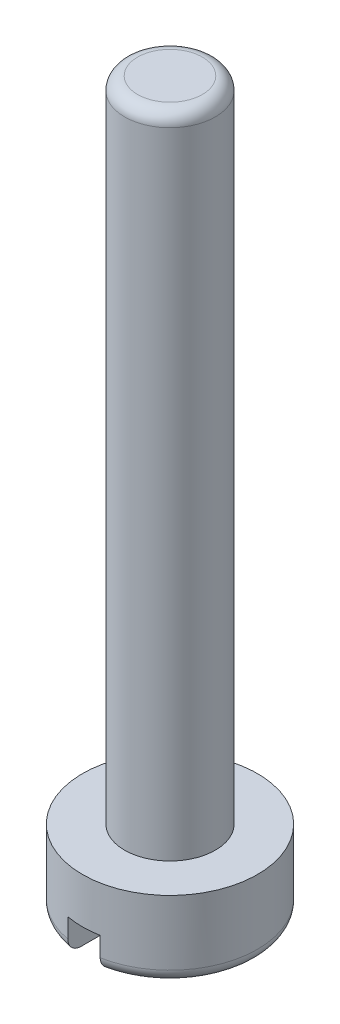
from build123d import *

# Parameters (mm, degrees)
SKETCH2_R               = 1.35
BOSS_EXTRUDE1_DEPTH     = 1.2
SKETCH3_R               = 0.7
BOSS_EXTRUDE2_DEPTH     = 10
CUT_EXTRUDE1_DEPTH      = 10
CUT_EXTRUDE1_DEPTH_BACK = 10
SKETCH4_W               = 0.5
SKETCH4_H               = 0.5
FILLET1_R               = 0.2


with BuildPart() as part:
    # Sketch2 → Boss-Extrude1 (new body)
    with BuildSketch(Plane(origin=(0, 0, 0), x_dir=(1, 0, 0), z_dir=(0, 1, 0))):
        Circle(SKETCH2_R)
    extrude(amount=BOSS_EXTRUDE1_DEPTH)

    # Sketch3 → Boss-Extrude2 (add)
    with BuildSketch(Plane(origin=(0, 1.2, 0), x_dir=(1, 0, 0), z_dir=(0, 1, 0))):
        Circle(SKETCH3_R)
    extrude(amount=BOSS_EXTRUDE2_DEPTH)

    # Sketch4 → Cut-Extrude1 (cut, two sides: drawn at the far end of the back side and taken through both)
    with BuildSketch(Plane.XY.offset(-CUT_EXTRUDE1_DEPTH_BACK)):
        with Locations((0, 0.25)):
            Rectangle(SKETCH4_W, SKETCH4_H)
    extrude(amount=CUT_EXTRUDE1_DEPTH + CUT_EXTRUDE1_DEPTH_BACK, mode=Mode.SUBTRACT)

    # Fillet1
    fillet1_edges = [part.edges().sort_by_distance(p)[0] for p in [
        (1.039230485, 0, 0.861684397),
        (-1.35, 0, 0),
        (-0.7, 11.2, 0),
    ]]
    fillet(fillet1_edges, radius=FILLET1_R)


solid = part.part
